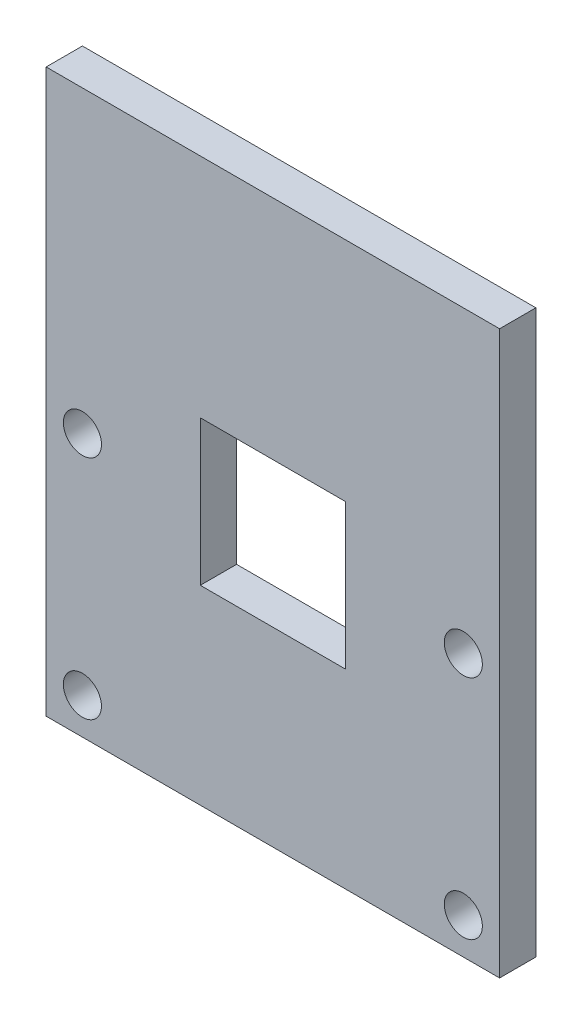
from build123d import *

# Parameters (mm, degrees)
ESQUISSE1_W        = 25
ESQUISSE1_H        = 31
ESQUISSE1_R        = 1.05
ESQUISSE1_W_2      = 8
ESQUISSE1_H_2      = 8
BOSS_EXTRU_1_DEPTH = 2


with BuildPart() as part:
    # Esquisse1 → Boss.-Extru.1 (new body)
    with BuildSketch(Plane.XY):
        with Locations((-19.750852345, -33.495163441)):
            Rectangle(ESQUISSE1_W, ESQUISSE1_H)
        with Locations((-30.250852345, -46.995163441)):
            Circle(ESQUISSE1_R, mode=Mode.SUBTRACT)
        with Locations((-9.250852345, -46.995163441)):
            Circle(ESQUISSE1_R, mode=Mode.SUBTRACT)
        with Locations((-30.250852345, -34.495163441)):
            Circle(ESQUISSE1_R, mode=Mode.SUBTRACT)
        with Locations((-9.250852345, -34.495163441)):
            Circle(ESQUISSE1_R, mode=Mode.SUBTRACT)
        with Locations((-19.750852345, -34.495163441)):
            Rectangle(ESQUISSE1_W_2, ESQUISSE1_H_2, mode=Mode.SUBTRACT)
    extrude(amount=BOSS_EXTRU_1_DEPTH)


solid = part.part
